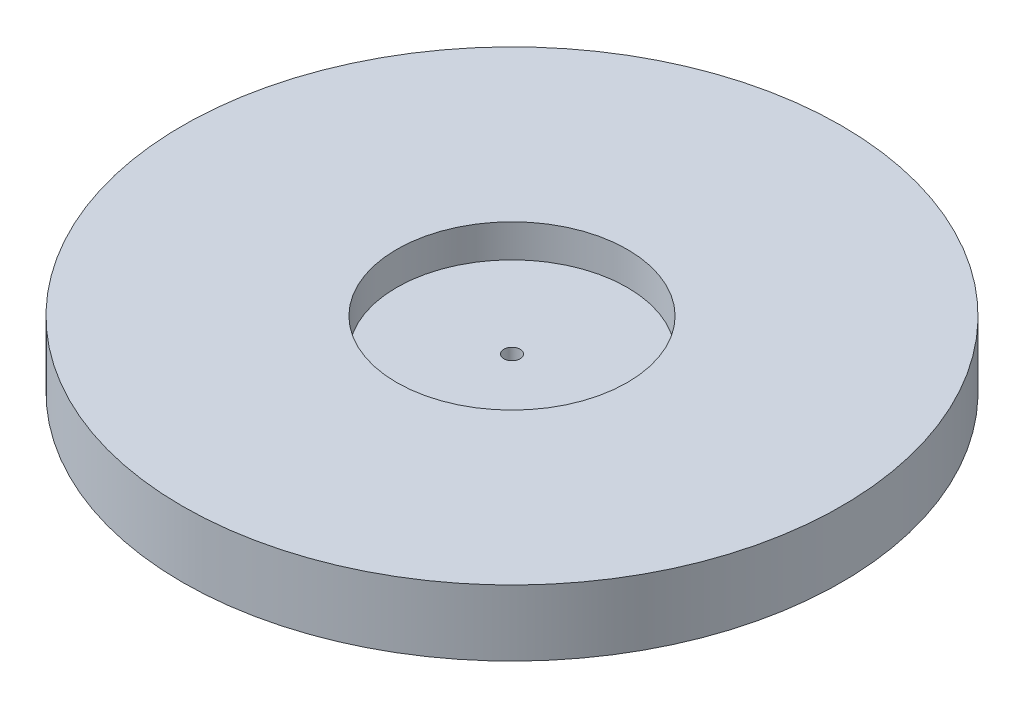
from build123d import *

# Parameters (mm, degrees)
SKETCH1_R           = 127
SKETCH1_R_2         = 3.175
BOSS_EXTRUDE1_DEPTH = 25.4
SKETCH3_R           = 44.45
CUT_EXTRUDE1_DEPTH  = 12.7


with BuildPart() as part:
    # Sketch1 → Boss-Extrude1 (new body)
    with BuildSketch(Plane(origin=(0, 0, 0), x_dir=(1, 0, 0), z_dir=(0, 1, 0))):
        with Locations(Location((0, 0, 0), (0, 0, 270))):
            Circle(SKETCH1_R)
        with Locations(Location((0, 0, 0), (0, 0, 270))):
            Circle(SKETCH1_R_2, mode=Mode.SUBTRACT)
    extrude(amount=BOSS_EXTRUDE1_DEPTH)

    # Sketch3 → Cut-Extrude1 (cut)
    with BuildSketch(Plane(origin=(0, 25.4, 0), x_dir=(1, 0, 0), z_dir=(0, 1, 0))):
        with Locations(Location((0, 0, 0), (0, 0, 270))):
            Circle(SKETCH3_R)
    extrude(amount=-CUT_EXTRUDE1_DEPTH, mode=Mode.SUBTRACT)


solid = part.part
